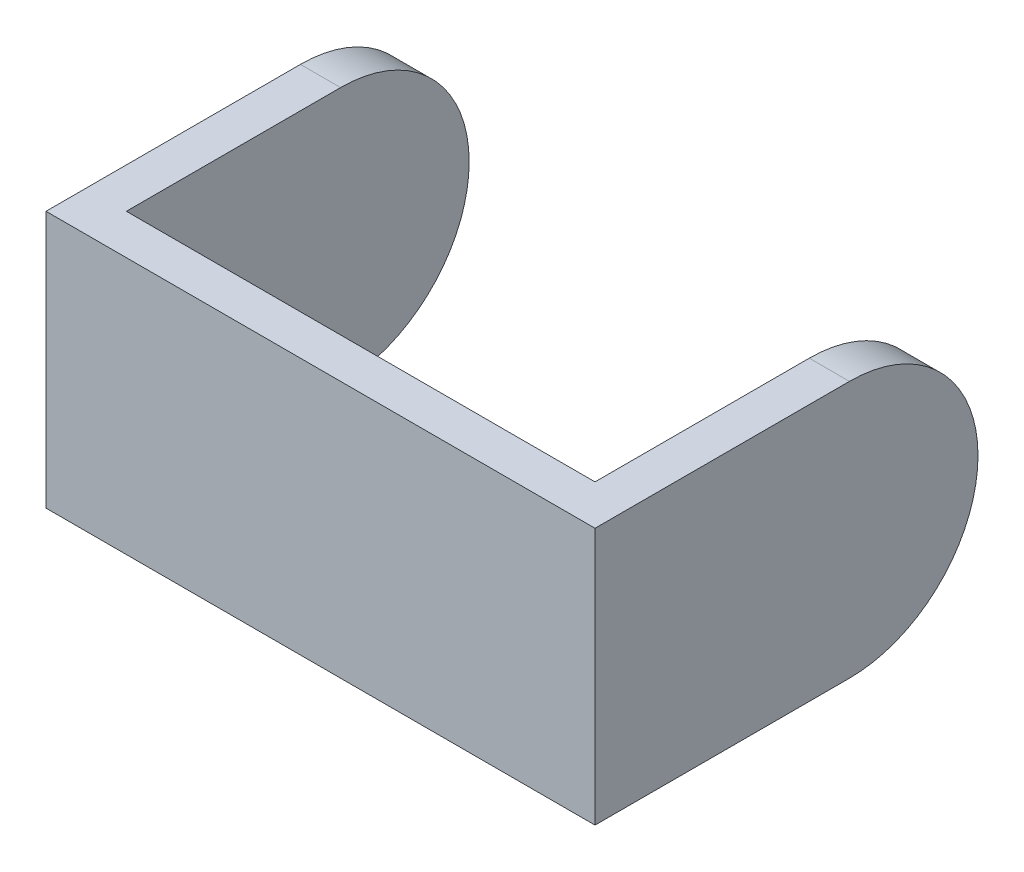
from build123d import *

# Parameters (mm, degrees)
BOSS_EXTRUDE1_DEPTH = 3
SKETCH1_3_W         = 3
SKETCH1_3_H         = 19.2
BOSS_EXTRUDE2_DEPTH = 38
BOSS_EXTRUDE3_START = -38
BOSS_EXTRUDE3_DEPTH = 38
CUT_EXTRUDE1_START  = -35
CUT_EXTRUDE1_DEPTH  = 35


with BuildPart() as part:
    # Sketch1 → Boss-Extrude1 (new body)
    with BuildSketch(Plane(origin=(0, 0, 0), x_dir=(0, 0, -1), z_dir=(1, 0, 0))):
        with BuildLine():
            ThreePointArc((0, -9.6), (9.6, 0), (0, 9.6))
            Line((0, 9.6), (-19, 9.6))
            Line((-19, 9.6), (-19, -9.6))
            Line((-19, -9.6), (0, -9.6))
        make_face()
    extrude(amount=BOSS_EXTRUDE1_DEPTH)

    # Sketch1<3> → Boss-Extrude2 (add)
    with BuildSketch(Plane(origin=(0, 0, 0), x_dir=(0, 0, -1), z_dir=(1, 0, 0))):
        with Locations((-17.5, 0)):
            Rectangle(SKETCH1_3_W, SKETCH1_3_H)
    extrude(amount=-BOSS_EXTRUDE2_DEPTH)

    # Sketch1<4> → Boss-Extrude3 (add)
    with BuildSketch(Plane(origin=(0, 0, 0), x_dir=(0, 0, -1), z_dir=(1, 0, 0)).offset(BOSS_EXTRUDE3_START)):
        with BuildLine():
            Line((-16, -9.6), (0, -9.6))
            ThreePointArc((0, -9.6), (9.6, 0), (0, 9.6))
            Line((0, 9.6), (-16, 9.6))
            Line((-16, 9.6), (-16, -9.6))
        make_face()
    extrude(amount=BOSS_EXTRUDE3_DEPTH)

    # Sketch1<5> → Cut-Extrude1 (cut)
    with BuildSketch(Plane(origin=(0, 0, 0), x_dir=(0, 0, -1), z_dir=(1, 0, 0)).offset(CUT_EXTRUDE1_START)):
        with BuildLine():
            Line((-16, -9.6), (0, -9.6))
            ThreePointArc((0, -9.6), (9.6, 0), (0, 9.6))
            Line((0, 9.6), (-16, 9.6))
            Line((-16, 9.6), (-16, -9.6))
        make_face()
    extrude(amount=CUT_EXTRUDE1_DEPTH, mode=Mode.SUBTRACT)


solid = part.part
